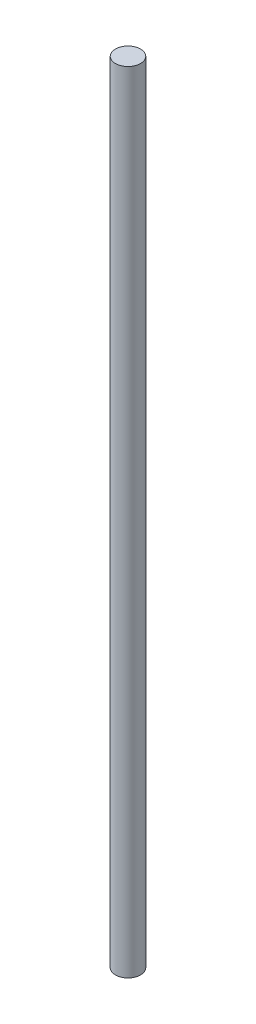
from build123d import *

# Parameters (mm, degrees)
SKETCH_1_R      = 2.5
EXTRUDE_1_DEPTH = 157


with BuildPart() as part:
    # Эскиз1 → Вытянуть1 (new body)
    with BuildSketch(Plane(origin=(0, 0, 0), x_dir=(1, 0, 0), z_dir=(0, 1, 0))):
        with Locations(Location((0, 0, 0), (0, 0, 270))):
            Circle(SKETCH_1_R)
    extrude(amount=EXTRUDE_1_DEPTH)


solid = part.part
